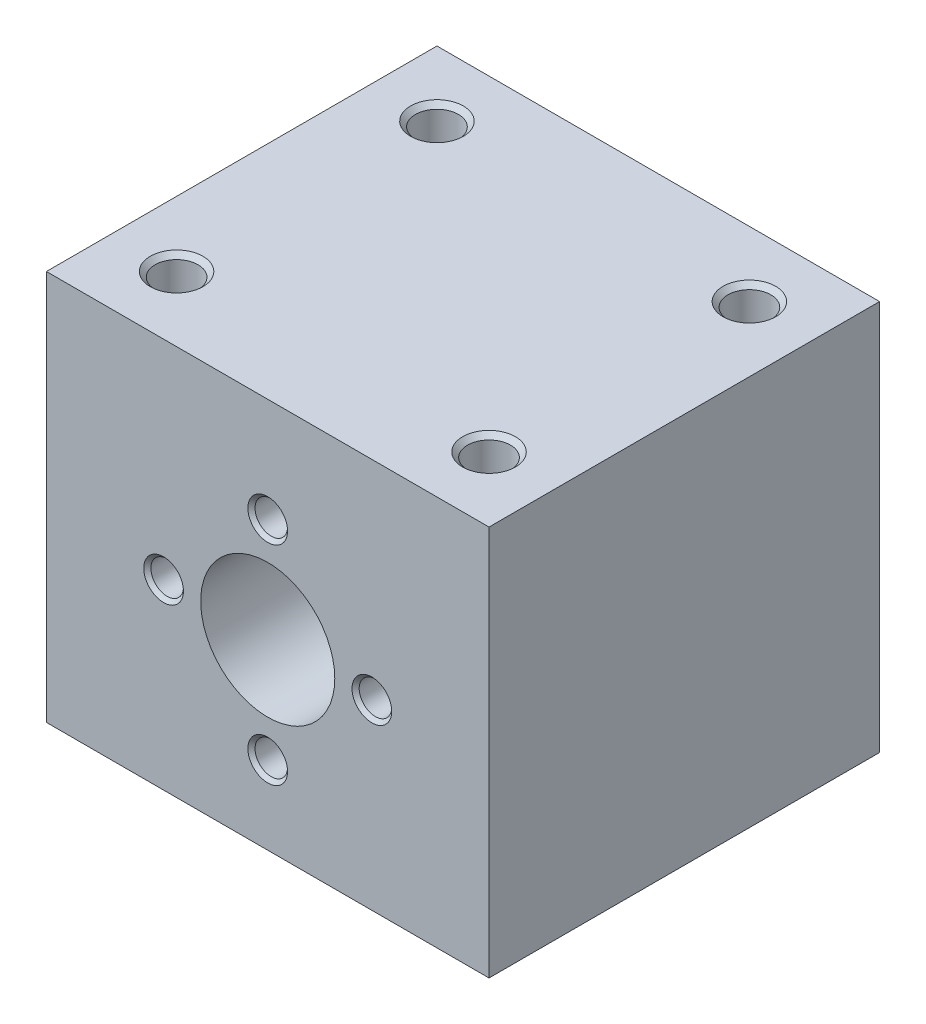
from build123d import *

# Parameters (mm, degrees)
SKETCH_1_W                   = 34
SKETCH_1_H                   = 30
SKETCH_1_R                   = 5.15
EXTRUDE_1_DEPTH              = 30
HOLE_WIZARD_M4_1_D           = 3.3
HOLE_WIZARD_M4_1_DEPTH       = 12.1
HOLE_WIZARD_M4_1_CSINK_D     = 4.05
HOLE_WIZARD_M4_1_CSINK_ANGLE = 90
HOLE_WIZARD_M4_1_TIP         = 0.991420021
HOLE_WIZARD_M3_1_D           = 2.5
HOLE_WIZARD_M3_1_DEPTH       = 7.5
HOLE_WIZARD_M3_1_CSINK_D     = 3.05
HOLE_WIZARD_M3_1_CSINK_ANGLE = 90
HOLE_WIZARD_M3_1_TIP         = 0.751075774


with BuildPart() as part:
    # 草图1 → 凸台-拉伸1 (new body)
    with BuildSketch(Plane.XY):
        with Locations((0, 1)):
            Rectangle(SKETCH_1_W, SKETCH_1_H)
        Circle(SKETCH_1_R, mode=Mode.SUBTRACT)
    extrude(amount=EXTRUDE_1_DEPTH)

    # M4 螺纹孔1
    with Locations(Plane(origin=(0, 16, 0), x_dir=(1, 0, 0), z_dir=(0, 1, 0))):
        with Locations((-12, -5), (12, -5), (-12, -25), (12, -25)):
            CounterSinkHole(HOLE_WIZARD_M4_1_D / 2, HOLE_WIZARD_M4_1_CSINK_D / 2, depth=HOLE_WIZARD_M4_1_DEPTH, counter_sink_angle=HOLE_WIZARD_M4_1_CSINK_ANGLE)
            with Locations((0, 0, -(HOLE_WIZARD_M4_1_DEPTH + HOLE_WIZARD_M4_1_TIP / 2))):  # 118° drill point
                Cone(0, HOLE_WIZARD_M4_1_D / 2, HOLE_WIZARD_M4_1_TIP, mode=Mode.SUBTRACT)

    # M3 螺纹孔1
    with Locations(Plane.XY.offset(30)):
        with Locations((0, 8), (-8, 0), (8, 0), (0, -8)):
            CounterSinkHole(HOLE_WIZARD_M3_1_D / 2, HOLE_WIZARD_M3_1_CSINK_D / 2, depth=HOLE_WIZARD_M3_1_DEPTH, counter_sink_angle=HOLE_WIZARD_M3_1_CSINK_ANGLE)
            with Locations((0, 0, -(HOLE_WIZARD_M3_1_DEPTH + HOLE_WIZARD_M3_1_TIP / 2))):  # 118° drill point
                Cone(0, HOLE_WIZARD_M3_1_D / 2, HOLE_WIZARD_M3_1_TIP, mode=Mode.SUBTRACT)


solid = part.part
